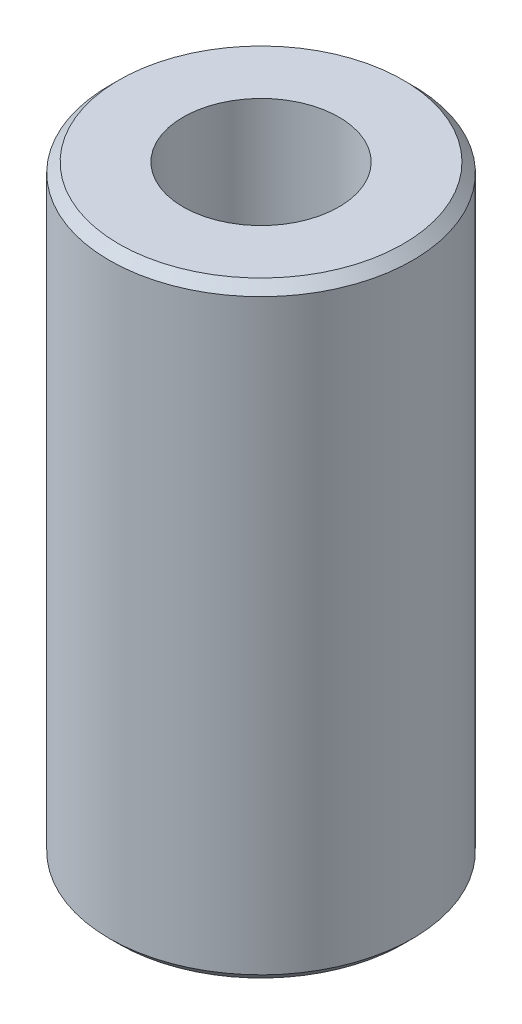
from build123d import *

# Parameters (mm, degrees)
CROQUIS2_R                = 6.35
SALIENTE_EXTRUIR1_DEPTH   = 12.7
CHAFL_N1_SIZE             = 0.396875
CLEARANCE_HOLE_DEPTH      = 16.554259867
CLEARANCE_HOLE_DEPTH_BACK = 16.554259867
CROQUIS4_R                = 3.2639


with BuildPart() as part:
    # Croquis2 → Saliente-Extruir1 (new, symmetric)
    with BuildSketch(Plane(origin=(0, 0, 0), x_dir=(1, 0, 0), z_dir=(0, 1, 0))):
        Circle(CROQUIS2_R)
    extrude(amount=SALIENTE_EXTRUIR1_DEPTH, both=True)

    # Chaflán1
    chafl_n1_edges = [part.edges().sort_by_distance(p)[0] for p in [
        (-6.35, -12.7, 0),
        (-6.35, 12.7, 0),
    ]]
    chamfer(chafl_n1_edges, length=CHAFL_N1_SIZE)

    # Croquis4 → Clearance Hole (cut, two sides: drawn at the far end of the back side and taken through both)
    with BuildSketch(Plane(origin=(0, 0, 0), x_dir=(1, 0, 0), z_dir=(0, 1, 0)).offset(-CLEARANCE_HOLE_DEPTH_BACK)):
        Circle(CROQUIS4_R)
    extrude(amount=CLEARANCE_HOLE_DEPTH + CLEARANCE_HOLE_DEPTH_BACK, mode=Mode.SUBTRACT)


solid = part.part
